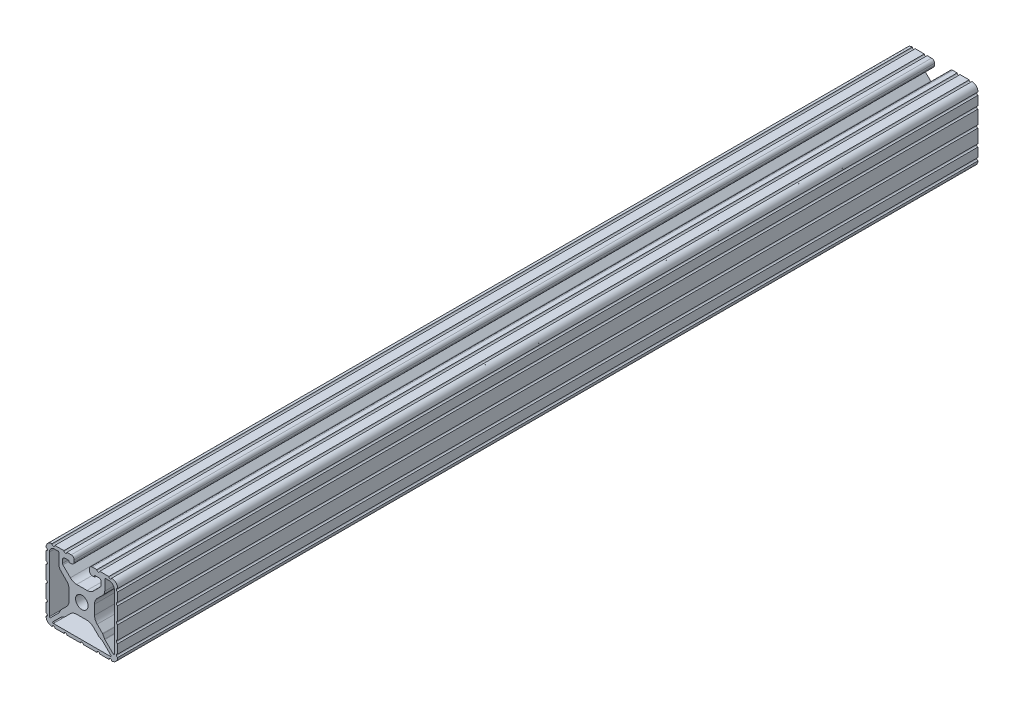
from build123d import *

# Parameters (mm, degrees)
SKETCH1_R      = 3.3274
EXTRUDE1_DEPTH = 457.2


with BuildPart() as part:
    # Sketch1 → Extrude1 (new body)
    with BuildSketch(Plane.XY):
        with BuildLine():
            Line((6.814144258, 15.824710921), (9.017, 15.824710921))
            ThreePointArc((9.017, 15.824710921), (9.915025612, 15.452736533), (10.287, 14.554710921))
            Line((10.287, 14.554710921), (10.287, 12.815421755))
            ThreePointArc((10.287, 12.815421755), (10.219314574, 12.47518159), (10.026564972, 12.186750874))
            Line((10.026564972, 12.186750874), (6.100754025, 8.261601293))
            ThreePointArc((6.100754025, 8.261601293), (4.55990611, 7.23218044), (2.742421178, 6.8707))
            Line((2.742421178, 6.8707), (-2.742421178, 6.8707))
            ThreePointArc((-2.742421178, 6.8707), (-4.55990611, 7.23218044), (-6.100754025, 8.261601293))
            Line((-6.100754025, 8.261601293), (-10.026564972, 12.186750874))
            ThreePointArc((-10.026564972, 12.186750874), (-10.219314574, 12.47518159), (-10.287, 12.815421755))
            Line((-10.287, 12.815421755), (-10.287, 14.554710921))
            ThreePointArc((-10.287, 14.554710921), (-9.915025612, 15.452736533), (-9.017, 15.824710921))
            Line((-9.017, 15.824710921), (-6.814144258, 15.824710921))
            Line((-6.814144258, 15.824710921), (-6.814144258, 14.986))
            Line((-6.814144258, 14.986), (-5.6388, 14.986))
            ThreePointArc((-5.6388, 14.986), (-4.525248241, 15.447248241), (-4.064, 16.5608))
            Line((-4.064, 16.5608), (-4.064, 17.4752))
            ThreePointArc((-4.064, 17.4752), (-4.525248241, 18.588751759), (-5.6388, 19.05))
            Line((-5.6388, 19.05), (-7.9756, 19.05))
            ThreePointArc((-7.9756, 19.05), (-8.7376, 18.288), (-9.4996, 19.05))
            Line((-9.4996, 19.05), (-14.3256, 19.05))
            ThreePointArc((-14.3256, 19.05), (-15.0876, 18.288), (-15.8496, 19.05))
            Line((-15.8496, 19.05), (-15.875, 19.05))
            ThreePointArc((-15.875, 19.05), (-18.12006403, 18.12006403), (-19.05, 15.875))
            Line((-19.05, 15.875), (-19.05, 15.8496))
            ThreePointArc((-19.05, 15.8496), (-18.288, 15.0876), (-19.05, 14.3256))
            Line((-19.05, 14.3256), (-19.05, 9.4996))
            ThreePointArc((-19.05, 9.4996), (-18.288, 8.7376), (-19.05, 7.9756))
            Line((-19.05, 7.9756), (-19.05, 0.762))
            ThreePointArc((-19.05, 0.762), (-18.288, 0), (-19.05, -0.762))
            Line((-19.05, -0.762), (-19.05, -7.9756))
            ThreePointArc((-19.05, -7.9756), (-18.288, -8.7376), (-19.05, -9.4996))
            Line((-19.05, -9.4996), (-19.05, -14.3256))
            ThreePointArc((-19.05, -14.3256), (-18.288, -15.0876), (-19.05, -15.8496))
            Line((-19.05, -15.8496), (-19.05, -15.875))
            ThreePointArc((-19.05, -15.875), (-18.12006403, -18.12006403), (-15.875, -19.05))
            Line((-15.875, -19.05), (-15.8496, -19.05))
            ThreePointArc((-15.8496, -19.05), (-15.0876, -18.288), (-14.3256, -19.05))
            Line((-14.3256, -19.05), (-9.4996, -19.05))
            ThreePointArc((-9.4996, -19.05), (-8.7376, -18.288), (-7.9756, -19.05))
            Line((-7.9756, -19.05), (-0.762, -19.05))
            ThreePointArc((-0.762, -19.05), (0, -18.288), (0.762, -19.05))
            Line((0.762, -19.05), (7.9756, -19.05))
            ThreePointArc((7.9756, -19.05), (8.7376, -18.288), (9.4996, -19.05))
            Line((9.4996, -19.05), (14.3256, -19.05))
            ThreePointArc((14.3256, -19.05), (15.0876, -18.288), (15.8496, -19.05))
            Line((15.8496, -19.05), (15.875, -19.05))
            ThreePointArc((15.875, -19.05), (18.12006403, -18.12006403), (19.05, -15.875))
            Line((19.05, -15.875), (19.05, -15.8496))
            ThreePointArc((19.05, -15.8496), (18.288, -15.0876), (19.05, -14.3256))
            Line((19.05, -14.3256), (19.05, -9.4996))
            ThreePointArc((19.05, -9.4996), (18.288, -8.7376), (19.05, -7.9756))
            Line((19.05, -7.9756), (19.05, -0.762))
            ThreePointArc((19.05, -0.762), (18.288, 0), (19.05, 0.762))
            Line((19.05, 0.762), (19.05, 7.9756))
            ThreePointArc((19.05, 7.9756), (18.288, 8.7376), (19.05, 9.4996))
            Line((19.05, 9.4996), (19.05, 14.3256))
            ThreePointArc((19.05, 14.3256), (18.288, 15.0876), (19.05, 15.8496))
            Line((19.05, 15.8496), (19.05, 15.875))
            ThreePointArc((19.05, 15.875), (18.12006403, 18.12006403), (15.875, 19.05))
            Line((15.875, 19.05), (15.8496, 19.05))
            ThreePointArc((15.8496, 19.05), (15.0876, 18.288), (14.3256, 19.05))
            Line((14.3256, 19.05), (9.4996, 19.05))
            ThreePointArc((9.4996, 19.05), (8.7376, 18.288), (7.9756, 19.05))
            Line((7.9756, 19.05), (5.6388, 19.05))
            ThreePointArc((5.6388, 19.05), (4.525248241, 18.588751759), (4.064, 17.4752))
            Line((4.064, 17.4752), (4.064, 16.5608))
            ThreePointArc((4.064, 16.5608), (4.525248241, 15.447248241), (5.6388, 14.986))
            Line((5.6388, 14.986), (6.814144258, 14.986))
            Line((6.814144258, 14.986), (6.814144258, 15.824710921))
        make_face()
        Circle(SKETCH1_R, mode=Mode.SUBTRACT)
        with BuildLine():
            Line((17.272, -15.193619561), (17.272, 14.478))
            ThreePointArc((17.272, 14.478), (16.453656347, 16.453656347), (14.478, 17.272))
            Line((14.478, 17.272), (12.554627238, 17.272))
            ThreePointArc((12.554627238, 17.272), (12.285219554, 17.160407684), (12.173627238, 16.891))
            Line((12.173627238, 16.891), (12.173627238, 11.224276306))
            ThreePointArc((12.173627238, 11.224276306), (11.931893574, 10.009132858), (11.243502135, 8.979023159))
            Line((11.243502135, 8.979023159), (8.147867153, 5.883909687))
            ThreePointArc((8.147867153, 5.883909687), (7.118033561, 4.342865578), (6.7564, 2.525010979))
            Line((6.7564, 2.525010979), (6.7564, -2.638829998))
            ThreePointArc((6.7564, -2.638829998), (7.117934192, -4.456444709), (8.147499936, -5.99736151))
            Line((8.147499936, -5.99736151), (10.978133922, -8.828137555))
            ThreePointArc((10.978133922, -8.828137555), (11.047042355, -8.907266312), (11.104427332, -8.995111041))
            Line((11.104427332, -8.995111041), (12.13998256, -10.847500325))
            ThreePointArc((12.13998256, -10.847500325), (12.197373304, -10.935352679), (12.266289489, -11.014487331))
            Line((12.266289489, -11.014487331), (16.687520892, -15.435718734))
            ThreePointArc((16.687520892, -15.435718734), (17.060643194, -15.509937374), (17.272, -15.193619561))
        make_face(mode=Mode.SUBTRACT)
        with BuildLine():
            Line((-12.173627238, 11.224276306), (-12.173627238, 16.891))
            ThreePointArc((-12.173627238, 16.891), (-12.285219554, 17.160407684), (-12.554627238, 17.272))
            Line((-12.554627238, 17.272), (-14.478, 17.272))
            ThreePointArc((-14.478, 17.272), (-16.453656347, 16.453656347), (-17.272, 14.478))
            Line((-17.272, 14.478), (-17.272, -15.193619561))
            ThreePointArc((-17.272, -15.193619561), (-17.060643194, -15.509937374), (-16.687520892, -15.435718734))
            Line((-16.687520892, -15.435718734), (-12.266289488, -11.014487333))
            ThreePointArc((-12.266289488, -11.014487333), (-12.197373302, -10.935352681), (-12.139982558, -10.847500326))
            Line((-12.139982558, -10.847500326), (-11.104427331, -8.995111042))
            ThreePointArc((-11.104427331, -8.995111042), (-11.047042353, -8.907266313), (-10.978133921, -8.828137556))
            Line((-10.978133921, -8.828137556), (-8.147499934, -5.997361511))
            ThreePointArc((-8.147499934, -5.997361511), (-7.11793419, -4.45644471), (-6.756399998, -2.638829999))
            Line((-6.756399998, -2.638829999), (-6.756399998, 2.525010979))
            ThreePointArc((-6.756399998, 2.525010979), (-7.118033559, 4.342865578), (-8.147867152, 5.883909688))
            Line((-8.147867152, 5.883909688), (-11.243502135, 8.979023158))
            ThreePointArc((-11.243502135, 8.979023158), (-11.931893574, 10.009132857), (-12.173627238, 11.224276306))
        make_face(mode=Mode.SUBTRACT)
        with BuildLine():
            Line((15.358897182, -16.621566737), (11.090984974, -12.353654529))
            ThreePointArc((11.090984974, -12.353654529), (11.011857946, -12.284744111), (10.924014656, -12.227356929))
            Line((10.924014656, -12.227356929), (9.072208991, -11.192066981))
            ThreePointArc((9.072208991, -11.192066981), (8.984358076, -11.134674031), (8.905225153, -11.06575586))
            Line((8.905225153, -11.06575586), (6.101578488, -8.261968492))
            ThreePointArc((6.101578488, -8.261968492), (4.560603247, -7.232279806), (2.742878424, -6.870700004))
            Line((2.742878424, -6.870700004), (-2.742878422, -6.870700004))
            ThreePointArc((-2.742878422, -6.870700004), (-4.560603245, -7.232279806), (-6.101578486, -8.261968491))
            Line((-6.101578486, -8.261968491), (-8.905225151, -11.06575586))
            ThreePointArc((-8.905225151, -11.06575586), (-8.984358074, -11.134674031), (-9.072208989, -11.19206698))
            Line((-9.072208989, -11.19206698), (-10.924014654, -12.227356929))
            ThreePointArc((-10.924014654, -12.227356929), (-11.011857944, -12.284744111), (-11.090984971, -12.353654529))
            Line((-11.090984971, -12.353654529), (-15.35889718, -16.621566737))
            ThreePointArc((-15.35889718, -16.621566737), (-15.441490846, -17.036793139), (-15.0894789, -17.272000001))
            Line((-15.0894789, -17.272000001), (15.089478903, -17.272000001))
            ThreePointArc((15.089478903, -17.272000001), (15.441490849, -17.036793139), (15.358897182, -16.621566737))
        make_face(mode=Mode.SUBTRACT)
    extrude(amount=-EXTRUDE1_DEPTH)


solid = part.part
